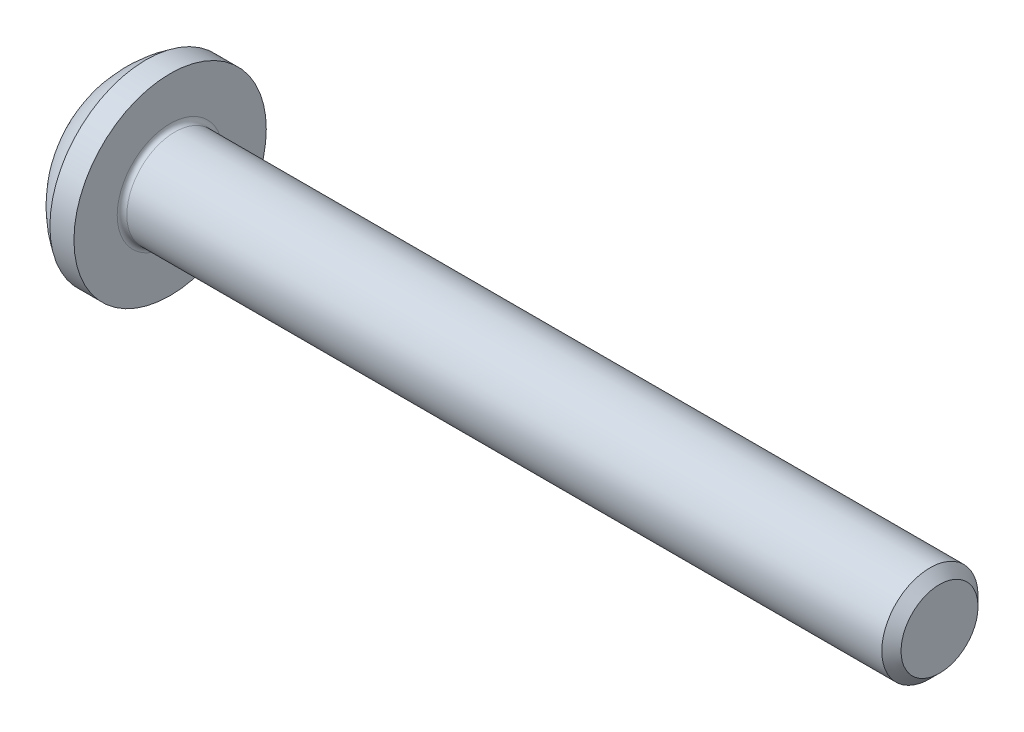
from build123d import *

# Parameters (mm, degrees)
CHAMFER_1_SIZE = 0.2


with BuildPart() as part:
    # 草图2 → Revolve 539 (revolve)
    with BuildSketch(Plane.XY):
        with BuildLine():
            Line((0, 0), (17.6, 0))
            Line((17.6, 0), (17.6, 1))
            Line((17.6, 1), (1.7, 1))
            ThreePointArc((1.7, 1), (1.629289322, 1.029289322), (1.6, 1.1))
            Line((1.6, 1.1), (1.6, 2))
            Line((1.6, 2), (1.1, 2))
            ThreePointArc((1.1, 2), (0.293143234, 1.141271221), (0, 0))
        make_face()
    revolve(axis=Axis((-1.331757704, 0, 0), (1, 0, 0)))

    # 草图5 → 切除-放样1 section 0
    with BuildSketch(Plane(origin=(0, 0, 0), x_dir=(0, 0, -1), z_dir=(1, 0, 0)), mode=Mode.PRIVATE) as loft_1_s0:
        with BuildLine():
            Line((0.25, 0.95), (-0.25, 0.95))
            Line((-0.25, 0.95), (-0.25, -0.95))
            Line((-0.25, -0.95), (0.25, -0.95))
            Line((0.25, -0.95), (0.25, 0.95))
        make_face()
    loft_1 = loft([Vertex(1.2, 0, 0), loft_1_s0.sketch], mode=Mode.SUBTRACT)

    # 镜向1: 切除-放样1 across plane
    add(loft_1.mirror(Plane(origin=(0, 0, 0), x_dir=(0, 0.7071067811865462, 0.7071067811865488), z_dir=(0, -0.7071067811865488, 0.7071067811865462))), mode=Mode.SUBTRACT)

    # 倒角1
    chamfer_1_edges = [part.edges().sort_by_distance(p)[0] for p in [
        (17.6, -1, 0),
    ]]
    chamfer(chamfer_1_edges, length=CHAMFER_1_SIZE)


solid = part.part
